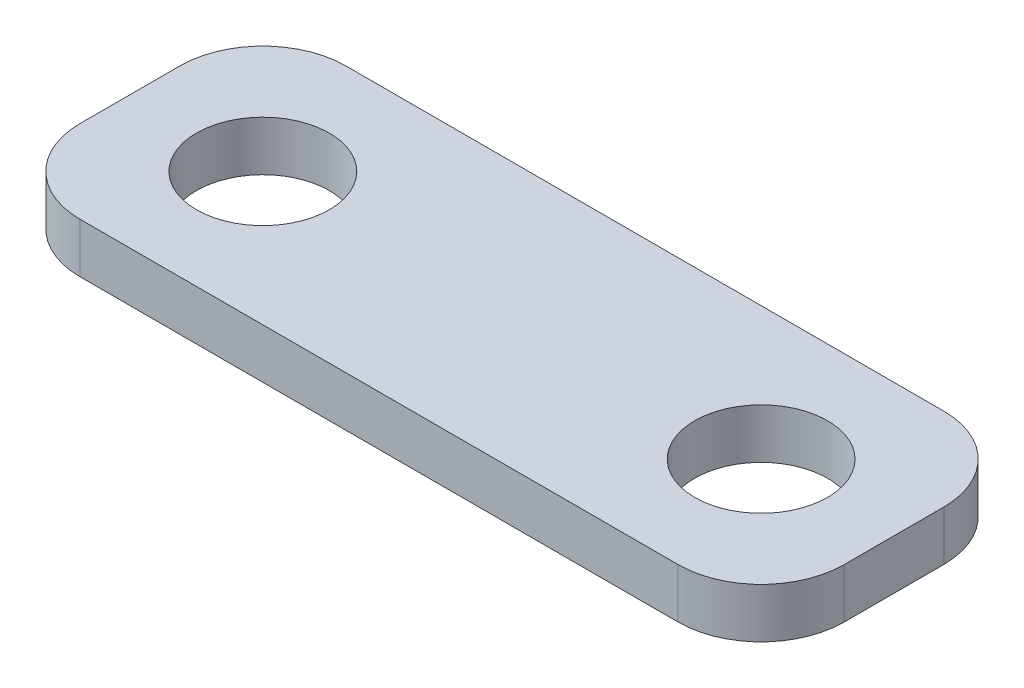
from build123d import *

# Parameters (mm, degrees)
SKETCH1_W           = 46
SKETCH1_H           = 16
SKETCH1_R           = 4
BOSS_EXTRUDE1_DEPTH = 3
FILLET1_R           = 5


with BuildPart() as part:
    # Sketch1 → Boss-Extrude1 (new body)
    with BuildSketch(Plane(origin=(0, 0, 0), x_dir=(1, 0, 0), z_dir=(0, 1, 0))):
        Rectangle(SKETCH1_W, SKETCH1_H)
        with Locations(Location((-15, 0, 0), (0, 0, 270))):
            Circle(SKETCH1_R, mode=Mode.SUBTRACT)
        with Locations(Location((15, 0, 0), (0, 0, 270))):
            Circle(SKETCH1_R, mode=Mode.SUBTRACT)
    extrude(amount=BOSS_EXTRUDE1_DEPTH)

    # Fillet1
    fillet1_edges = [part.edges().sort_by_distance(p)[0] for p in [
        (23, 1.5, 8),
        (-23, 1.5, 8),
        (-23, 1.5, -8),
        (23, 1.5, -8),
    ]]
    fillet(fillet1_edges, radius=FILLET1_R)


solid = part.part
